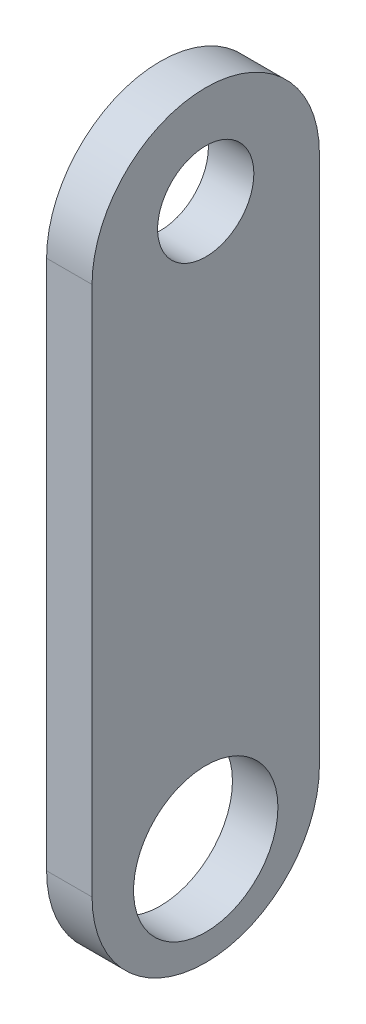
from build123d import *

# Parameters (mm, degrees)
SKETCH3_W           = 15
SKETCH3_H           = 50
BOSS_EXTRUDE1_DEPTH = 3
SKETCH4_R           = 3.175
SKETCH4_R_2         = 4.7625
CUT_EXTRUDE1_DEPTH  = 5
FILLET1_RADIUS      = 7.5
FILLET1_LENGTH      = 3
FILLET2_RADIUS      = 7.5
FILLET2_LENGTH      = 3


with BuildPart() as part:
    # Sketch3 → Boss-Extrude1 (new body)
    with BuildSketch(Plane(origin=(0, 0, 0), x_dir=(0, 0, -1), z_dir=(1, 0, 0))):
        Rectangle(SKETCH3_W, SKETCH3_H)
    extrude(amount=BOSS_EXTRUDE1_DEPTH)

    # Sketch4 → Cut-Extrude1 (cut)
    with BuildSketch(Plane(origin=(3, 0, 0), x_dir=(0, 0, -1), z_dir=(1, 0, 0))):
        with Locations((0, 18.5)):
            Circle(SKETCH4_R)
        with Locations((0, -18.5)):
            Circle(SKETCH4_R_2)
    extrude(amount=-CUT_EXTRUDE1_DEPTH, mode=Mode.SUBTRACT)

    # Fillet1: full round fillet: the end face becomes a half cylinder, R = half its width
    fillet1_face = Plane((1.5, 25, 0), x_dir=(-1, 0, 0), z_dir=(0, 1, 0))  # on the end face: x along it, z out of the body
    fillet1_slab = fillet1_face.offset(-FILLET1_RADIUS / 2) * Box(FILLET1_LENGTH, 2 * FILLET1_RADIUS, FILLET1_RADIUS, mode=Mode.PRIVATE)  # the body's end, R deep
    fillet1_round = Plane((1.5, 17.5, 0), x_dir=(0, 1, 0), z_dir=(-1, 0, 0)) * Cylinder(FILLET1_RADIUS, FILLET1_LENGTH, mode=Mode.PRIVATE)  # its axis R under the face
    add(fillet1_slab - fillet1_round, mode=Mode.SUBTRACT)

    # Fillet2: full round fillet: the end face becomes a half cylinder, R = half its width
    fillet2_face = Plane((1.5, -25, 0), x_dir=(-1, 0, 0), z_dir=(0, -1, 0))  # on the end face: x along it, z out of the body
    fillet2_slab = fillet2_face.offset(-FILLET2_RADIUS / 2) * Box(FILLET2_LENGTH, 2 * FILLET2_RADIUS, FILLET2_RADIUS, mode=Mode.PRIVATE)  # the body's end, R deep
    fillet2_round = Plane((1.5, -17.5, 0), x_dir=(0, -1, 0), z_dir=(-1, 0, 0)) * Cylinder(FILLET2_RADIUS, FILLET2_LENGTH, mode=Mode.PRIVATE)  # its axis R under the face
    add(fillet2_slab - fillet2_round, mode=Mode.SUBTRACT)


solid = part.part
